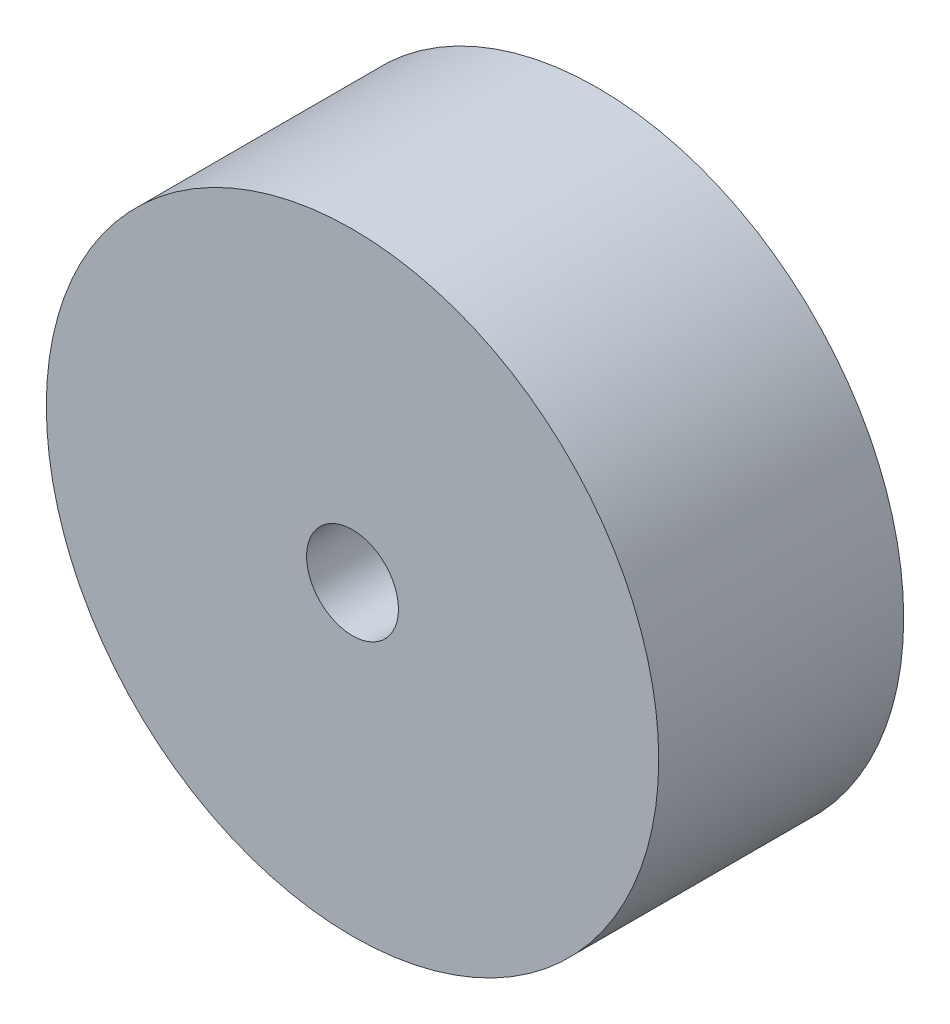
from build123d import *

# Parameters (mm, degrees)
SKETCH1_R           = 10
SKETCH1_R_2         = 1.5
BOSS_EXTRUDE1_DEPTH = 8


with BuildPart() as part:
    # Sketch1 → Boss-Extrude1 (new body)
    with BuildSketch(Plane.XY):
        Circle(SKETCH1_R)
        Circle(SKETCH1_R_2, mode=Mode.SUBTRACT)
    extrude(amount=BOSS_EXTRUDE1_DEPTH)


solid = part.part
